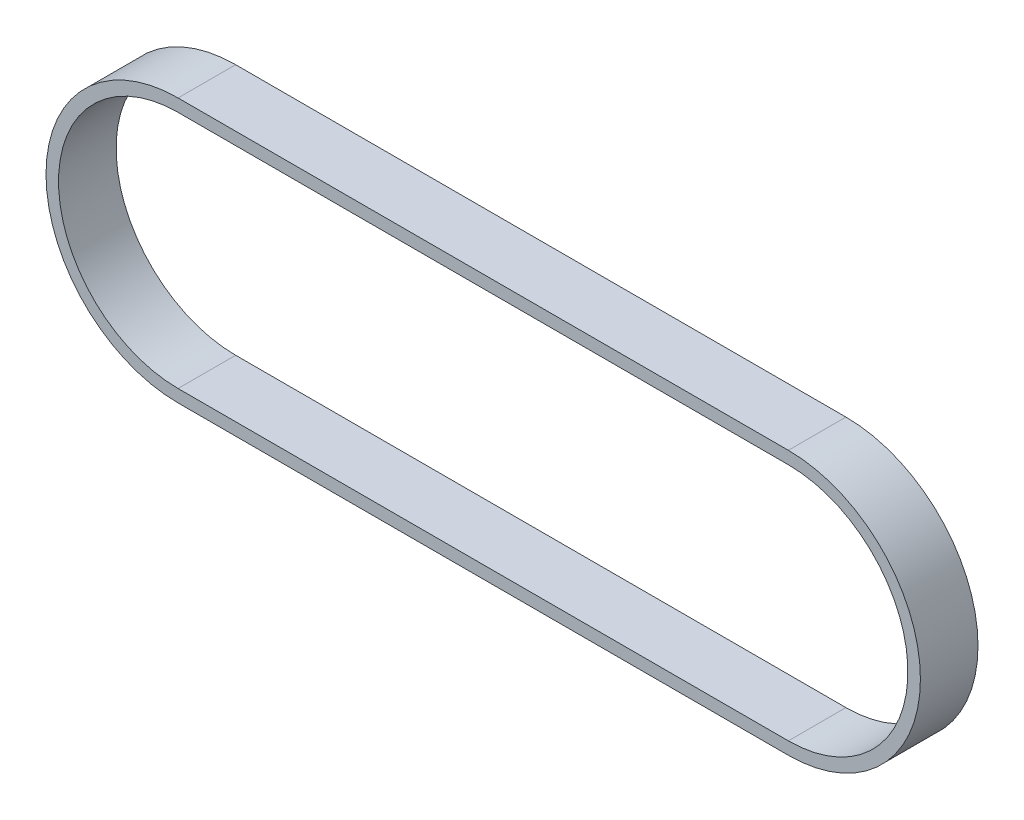
from build123d import *

# Parameters (mm, degrees)
EXTRUDE_THIN1_DEPTH = 9.2


with BuildPart() as part:
    # Sketch1 → Extrude-Thin1 (new body)
    with BuildSketch(Plane.XY):
        with BuildLine():
            Line((0, 21.1), (97.5, 21.1))
            ThreePointArc((97.5, 21.1), (118.6, 0), (97.5, -21.1))
            Line((97.5, -21.1), (0, -21.1))
            ThreePointArc((0, -21.1), (-21.1, 0), (0, 21.1))
        make_face()
        with BuildLine():
            Line((0, 19.1), (97.5, 19.1))
            ThreePointArc((97.5, 19.1), (116.6, 0), (97.5, -19.1))
            Line((97.5, -19.1), (0, -19.1))
            ThreePointArc((0, -19.1), (-19.1, 0), (0, 19.1))
        make_face(mode=Mode.SUBTRACT)
    extrude(amount=EXTRUDE_THIN1_DEPTH)


solid = part.part
